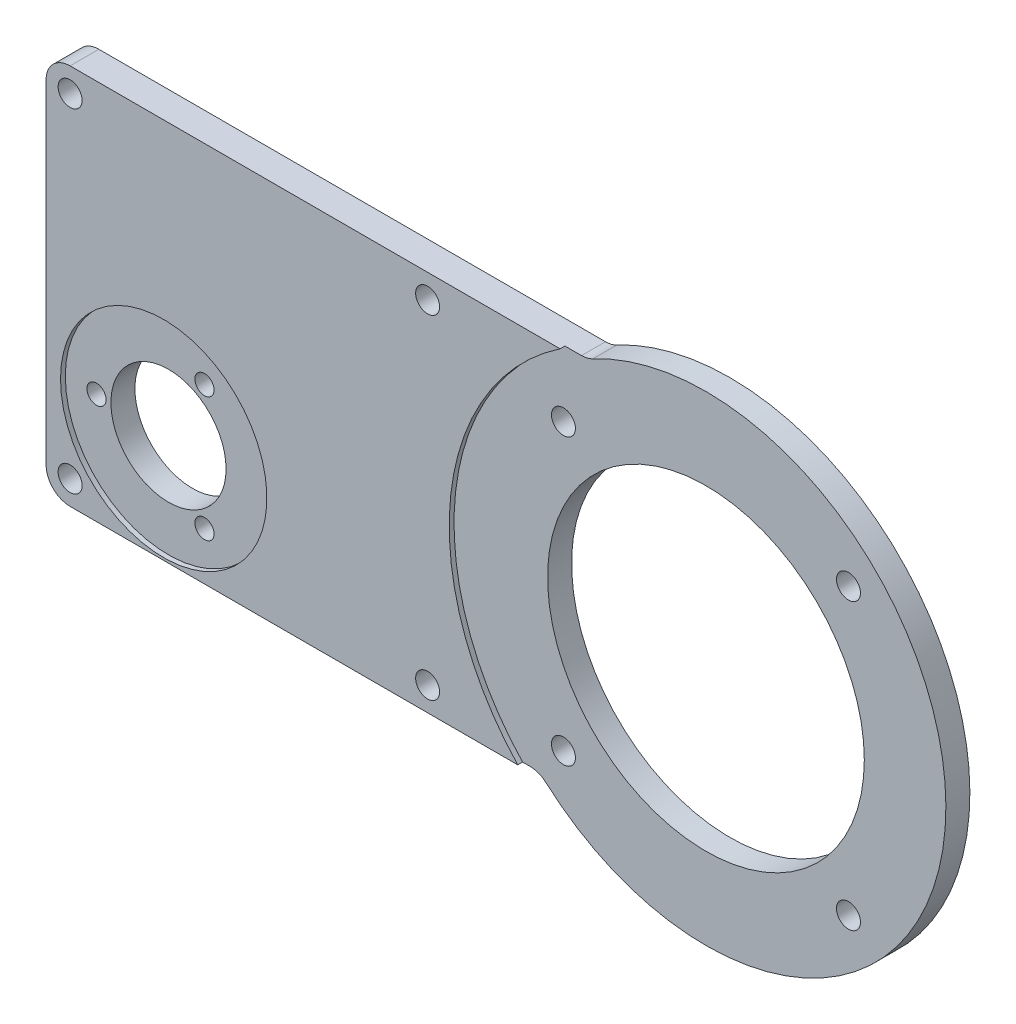
from build123d import *

# Parameters (mm, degrees)
EXTRUSION1_DEPTH                 = 12
ENL_V_START                      = -2
ENL_V_MAT_EXTRU_1_DEPTH          = 2
ESQUISSE3_R                      = 43
ENL_V_MAT_EXTRU_2_DEPTH          = 2
DIAM_TRE_DU_PER_AGE_M10_0_10_1_D = 10
DIAM_TRE_DU_PER_AGE_M10_0_10_2_D = 10
DIAM_TRE_DU_PER_AGE_M10_0_10_3_D = 10
DIAM_TRE_DU_PER_AGE_M10_0_10_4_D = 10
PER_AGE1_D                       = 132
DIAM_TRE_DU_PER_AGE_M10_0_10_5_D = 10
DIAM_TRE_DU_PER_AGE_M10_0_10_6_D = 10
DIAM_TRE_DU_PER_AGE_M8_0_8_1_D   = 8
DIAM_TRE_DU_PER_AGE_M8_0_8_2_D   = 8
DIAM_TRE_DU_PER_AGE_M8_0_8_3_D   = 8
D_GAGEMENT_M421_D                = 48
DIAM_TRE_DU_PER_AGE_M10_0_10_7_D = 10
DIAM_TRE_DU_PER_AGE_M10_0_10_8_D = 10


with BuildPart() as part:
    # Esquisse1 → Extrusion1 (new body)
    with BuildSketch(Plane(origin=(0, 0, 0), x_dir=(-1, 0, 0), z_dir=(0, 0, -1))):
        with BuildLine():
            Line((73.321211119, -72), (263, -72))
            ThreePointArc((263, -72), (270.071067812, -69.071067812), (273, -62))
            Line((273, -62), (273, 77))
            ThreePointArc((273, 77), (270.071067812, 84.071067812), (263, 87))
            Line((263, 87), (51.874849397, 87))
            ThreePointArc((51.874849397, 87), (49.443987223, 87.29995314), (47.158953998, 88.181818182))
            ThreePointArc((47.158953998, 88.181818182), (-99.289889427, -11.896127843), (66.655646472, -74.545454545))
            ThreePointArc((66.655646472, -74.545454545), (69.753680779, -72.65801267), (73.321211119, -72))
        make_face()
    extrude(amount=-EXTRUSION1_DEPTH)

    # Esquisse2 → Enlèv. mat.-Extru.1 (cut)
    with BuildSketch(Plane.XY.offset(12).offset(ENL_V_START)):
        with BuildLine():
            Line((-51.874849397, 87), (-58.787753827, 87))
            ThreePointArc((-58.787753827, 87), (-104.359806581, 11.577165901), (-76.426435217, -72))
            Line((-76.426435217, -72), (-73.321211119, -72))
            ThreePointArc((-73.321211119, -72), (-69.753680779, -72.65801267), (-66.655646472, -74.545454545))
            ThreePointArc((-66.655646472, -74.545454545), (99.289889427, -11.896127843), (-47.158953998, 88.181818182))
            ThreePointArc((-47.158953998, 88.181818182), (-49.443987223, 87.29995314), (-51.874849397, 87))
        make_face()
    extrude(amount=ENL_V_MAT_EXTRU_1_DEPTH, mode=Mode.SUBTRACT)

    # Esquisse3 → Enlèv. mat.-Extru.2 (cut)
    with BuildSketch(Plane.XY.offset(12)):
        with Locations(Location((-224, -28, 0), (0, 0, 180))):
            Circle(ESQUISSE3_R)
    extrude(amount=-ENL_V_MAT_EXTRU_2_DEPTH, mode=Mode.SUBTRACT)

    # Diamètre du perçage M10.0 (10)1 (through all)
    with Locations(Plane.XY.offset(10)):
        with Locations((59.39696962, -59.39696962)):
            Hole(DIAM_TRE_DU_PER_AGE_M10_0_10_1_D / 2)

    # Diamètre du perçage M10.0 (10)2 (through all)
    with Locations(Plane.XY.offset(10)):
        with Locations((59.39696962, 59.39696962)):
            Hole(DIAM_TRE_DU_PER_AGE_M10_0_10_2_D / 2)

    # Diamètre du perçage M10.0 (10)3 (through all)
    with Locations(Plane.XY.offset(12)):
        with Locations((-114, 77)):
            Hole(DIAM_TRE_DU_PER_AGE_M10_0_10_3_D / 2)

    # Diamètre du perçage M10.0 (10)4 (through all)
    with Locations(Plane.XY.offset(10)):
        with Locations((-59.39696962, 59.39696962)):
            Hole(DIAM_TRE_DU_PER_AGE_M10_0_10_4_D / 2)

    # Perçage1 (through all)
    with Locations(Plane.XY.offset(10)):
        with Locations((0, 0)):
            Hole(PER_AGE1_D / 2)

    # Diamètre du perçage M10.0 (10)5 (through all)
    with Locations(Plane.XY.offset(10)):
        with Locations((-59.39696962, -59.39696962)):
            Hole(DIAM_TRE_DU_PER_AGE_M10_0_10_5_D / 2)

    # Diamètre du perçage M10.0 (10)6 (through all)
    with Locations(Plane.XY.offset(12)):
        with Locations((-114, -62)):
            Hole(DIAM_TRE_DU_PER_AGE_M10_0_10_6_D / 2)

    # Diamètre du perçage M8.0 (8)1 (through all)
    with Locations(Plane.XY.offset(10)):
        with Locations((-209, -2.019237886)):
            Hole(DIAM_TRE_DU_PER_AGE_M8_0_8_1_D / 2)

    # Diamètre du perçage M8.0 (8)2 (through all)
    with Locations(Plane.XY.offset(10)):
        with Locations((-254, -28)):
            Hole(DIAM_TRE_DU_PER_AGE_M8_0_8_2_D / 2)

    # Diamètre du perçage M8.0 (8)3 (through all)
    with Locations(Plane.XY.offset(10)):
        with Locations((-209, -53.980762114)):
            Hole(DIAM_TRE_DU_PER_AGE_M8_0_8_3_D / 2)

    # Dégagement M421 (through all)
    with Locations(Plane.XY.offset(10)):
        with Locations((-224, -28)):
            Hole(D_GAGEMENT_M421_D / 2)

    # Diamètre du perçage M10.0 (10)7 (through all)
    with Locations(Plane.XY.offset(12)):
        with Locations((-263, -62)):
            Hole(DIAM_TRE_DU_PER_AGE_M10_0_10_7_D / 2)

    # Diamètre du perçage M10.0 (10)8 (through all)
    with Locations(Plane.XY.offset(12)):
        with Locations((-263, 77)):
            Hole(DIAM_TRE_DU_PER_AGE_M10_0_10_8_D / 2)


solid = part.part
